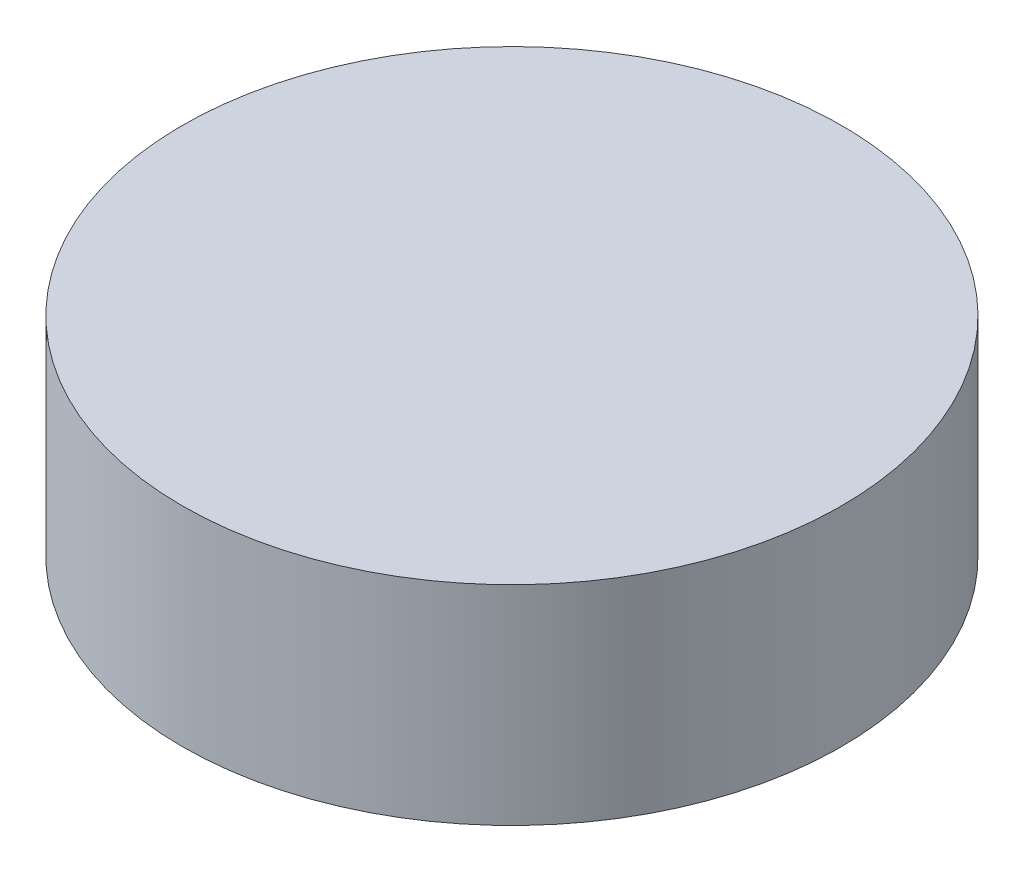
from build123d import *

# Parameters (mm, degrees)
SKETCH2_R           = 70.25
BOSS_EXTRUDE1_DEPTH = 44.45
SKETCH3_R           = 63.9
CUT_EXTRUDE1_DEPTH  = 38.5


with BuildPart() as part:
    # Sketch2 → Boss-Extrude1 (new body)
    with BuildSketch(Plane(origin=(0, 93.427588962, 0), x_dir=(1, 0, 0), z_dir=(0, 1, 0))):
        with Locations(Location((47.292360797, -96.352860024, 0), (0, 0, 270))):
            Circle(SKETCH2_R)
    extrude(amount=-BOSS_EXTRUDE1_DEPTH)

    # Sketch3 → Cut-Extrude1 (cut)
    with BuildSketch(Plane.XZ.offset(-48.977588962)):
        with Locations(Location((47.292360797, 96.352860024, 0), (0, 0, 270))):
            Circle(SKETCH3_R)
    extrude(amount=-CUT_EXTRUDE1_DEPTH, mode=Mode.SUBTRACT)


solid = part.part
